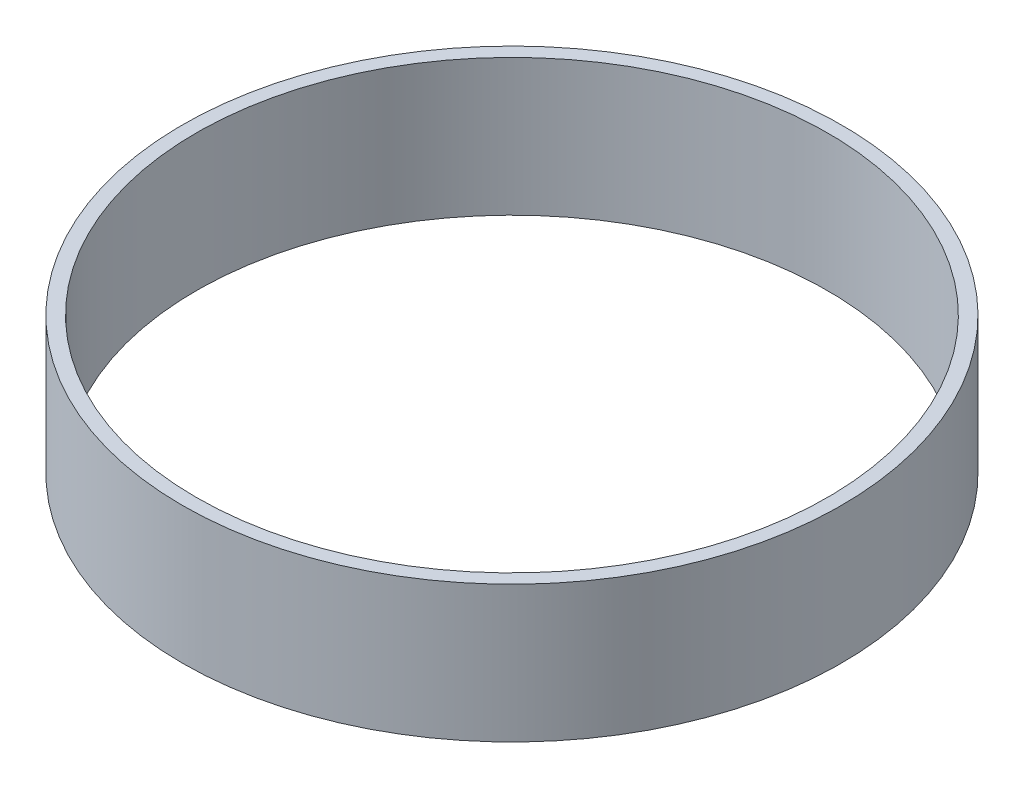
from build123d import *

# Parameters (mm, degrees)
SKETCH1_R           = 24.116
SKETCH1_R_2         = 23.1
BOSS_EXTRUDE1_DEPTH = 10


with BuildPart() as part:
    # Sketch1 → Boss-Extrude1 (new body)
    with BuildSketch(Plane(origin=(0, 0, 0), x_dir=(0.9995179941195831, 0, 0.031044797167406213), z_dir=(0, 1, 0))):
        with Locations(Location((-29.391570254, -2.611368154, 0), (0, 0, 271.779021696))):
            Circle(SKETCH1_R)
        with Locations(Location((-29.391570254, -2.611368154, 0), (0, 0, 271.779021696))):
            Circle(SKETCH1_R_2, mode=Mode.SUBTRACT)
    extrude(amount=BOSS_EXTRUDE1_DEPTH)


solid = part.part
